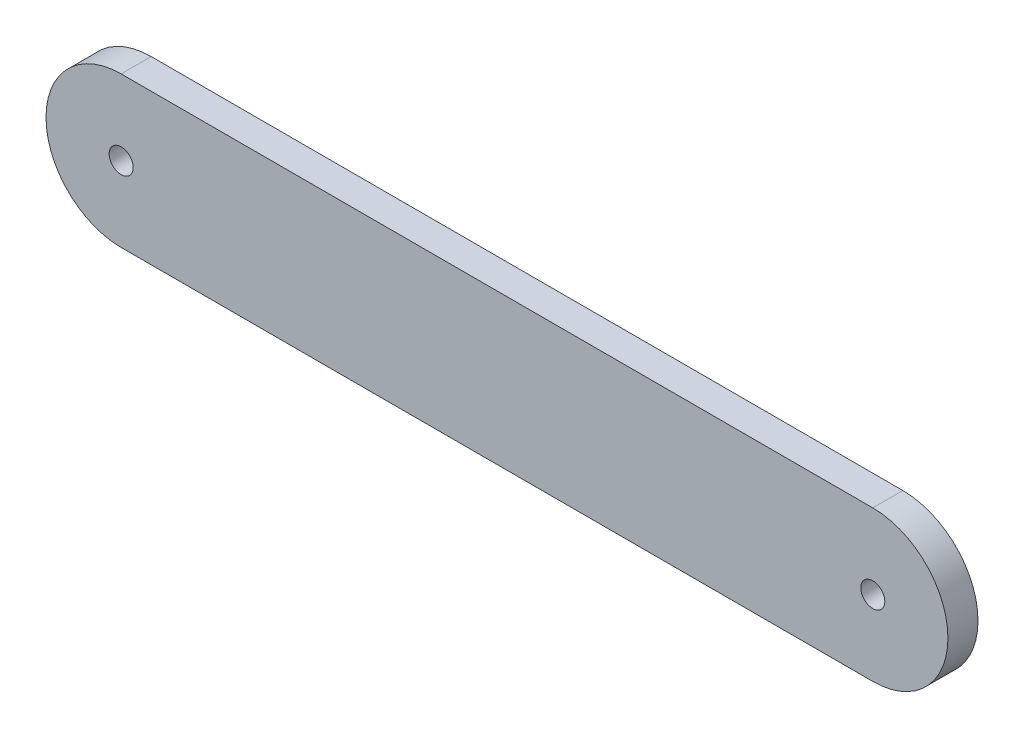
from build123d import *

# Parameters (mm, degrees)
SKETCH_1_R      = 1.6
EXTRUDE_1_DEPTH = 4


with BuildPart() as part:
    # ｽｹｯﾁ1 → ﾎﾞｽ - 押し出し1 (new body)
    with BuildSketch(Plane.XY):
        with BuildLine():
            Line((0, 10), (100, 10))
            ThreePointArc((100, 10), (110, 0), (100, -10))
            Line((100, -10), (0, -10))
            ThreePointArc((0, -10), (-10, 0), (0, 10))
        make_face()
        Circle(SKETCH_1_R, mode=Mode.SUBTRACT)
        with Locations((100, 0)):
            Circle(SKETCH_1_R, mode=Mode.SUBTRACT)
    extrude(amount=EXTRUDE_1_DEPTH)


solid = part.part
